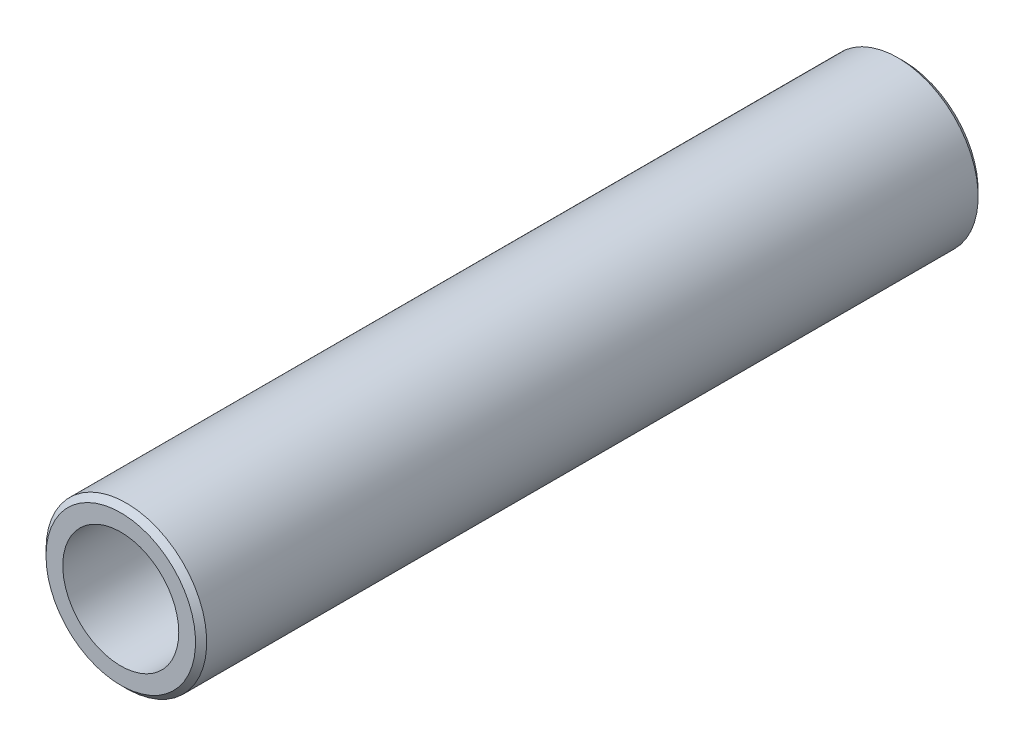
from build123d import *

# Parameters (mm, degrees)
CROQUIS1_R              = 5.75
SALIENTE_EXTRUIR1_DEPTH = 56
CROQUIS2_R              = 4.15
CORTAR_EXTRUIR1_DEPTH   = 59.333566666
CHAFL_N1_SIZE           = 0.4
CHAFL_N2_SIZE           = 0.4


with BuildPart() as part:
    # Croquis1 → Saliente-Extruir1 (new body)
    with BuildSketch(Plane(origin=(0, 0, 0), x_dir=(-1, 0, 0), z_dir=(0, 0, -1))):
        with Locations((-5.8, 5.8)):
            Circle(CROQUIS1_R)
    extrude(amount=-SALIENTE_EXTRUIR1_DEPTH)

    # Croquis2 → Cortar-Extruir1 (cut, through all)
    with BuildSketch(Plane.XY.offset(56)):
        with Locations((5.8, 5.8)):
            Circle(CROQUIS2_R)
    extrude(amount=-CORTAR_EXTRUIR1_DEPTH, mode=Mode.SUBTRACT)

    # Chaflán1
    chafl_n1_edges = [part.edges().sort_by_distance(p)[0] for p in [
        (11.55, 5.8, 0),
    ]]
    chamfer(chafl_n1_edges, length=CHAFL_N1_SIZE)

    # Chaflán2
    chafl_n2_edges = [part.edges().sort_by_distance(p)[0] for p in [
        (11.55, 5.8, 56),
    ]]
    chamfer(chafl_n2_edges, length=CHAFL_N2_SIZE)


solid = part.part
